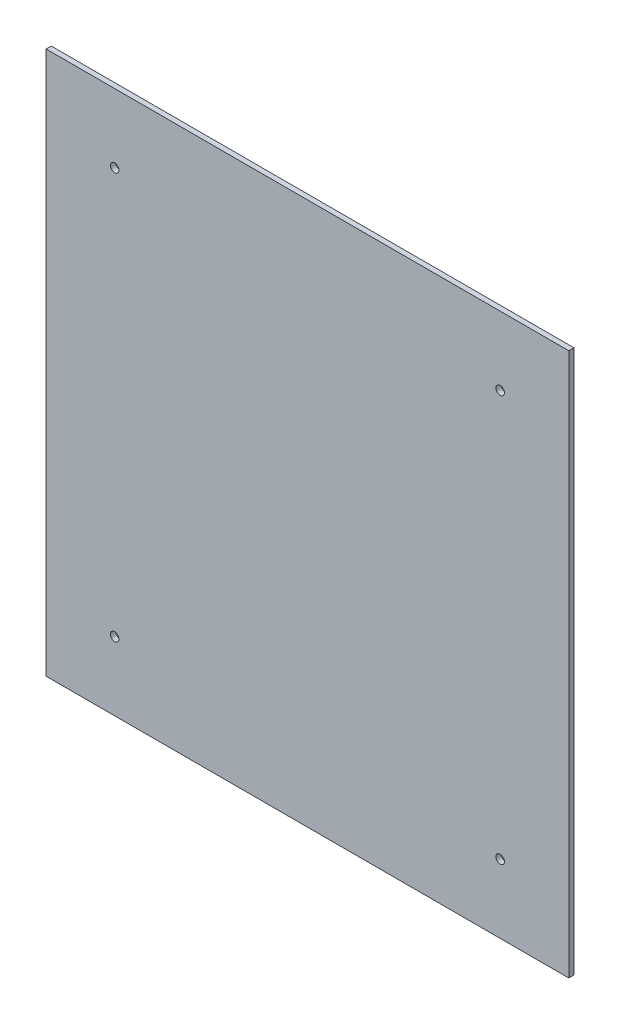
from build123d import *

# Parameters (mm, degrees)
SKETCH1_W           = 304.8
SKETCH1_H           = 316.8
BOSS_EXTRUDE1_DEPTH = 3
SKETCH2_R           = 2.5
CUT_EXTRUDE1_DEPTH  = 220.830207205


with BuildPart() as part:
    # Sketch1 → Boss-Extrude1 (new body)
    with BuildSketch(Plane.XY):
        Rectangle(SKETCH1_W, SKETCH1_H)
    extrude(amount=BOSS_EXTRUDE1_DEPTH)

    # Sketch2 → Cut-Extrude1 (cut, through all)
    with BuildSketch(Plane(origin=(0, 0, 0), x_dir=(-1, 0, 0), z_dir=(0, 0, -1))):
        with Locations((-112.4, 118.4)):
            Circle(SKETCH2_R)
        with Locations((112.4, 118.4)):
            Circle(SKETCH2_R)
        with Locations((112.4, -118.4)):
            Circle(SKETCH2_R)
        with Locations((-112.4, -118.4)):
            Circle(SKETCH2_R)
    extrude(amount=-CUT_EXTRUDE1_DEPTH, mode=Mode.SUBTRACT)


solid = part.part
